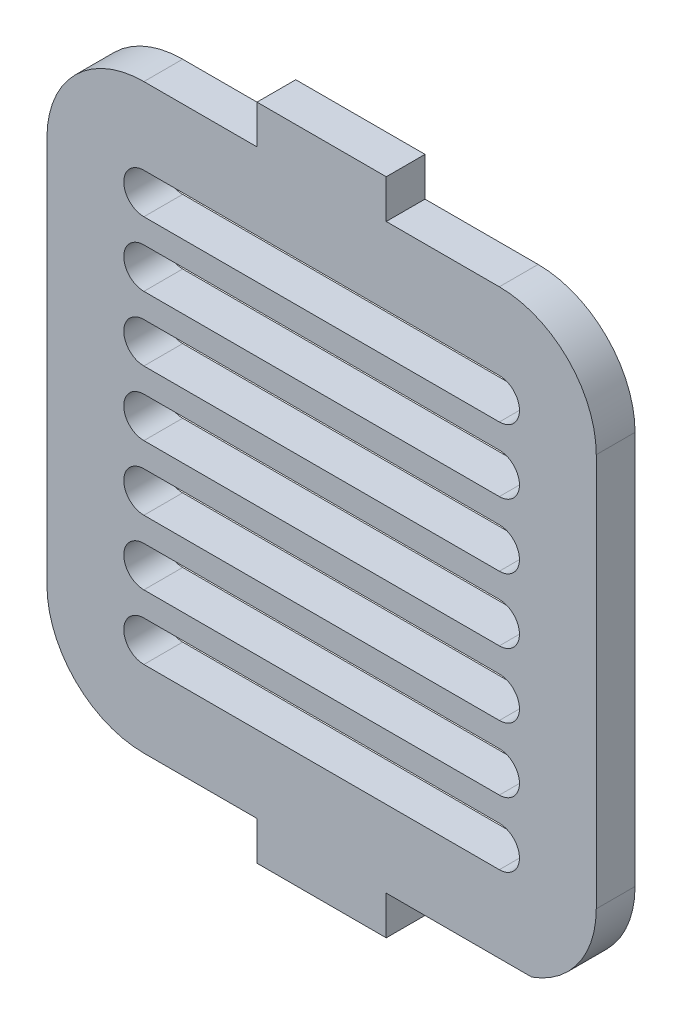
from build123d import *

# Parameters (mm, degrees)
SKETCH1_W           = 20
SKETCH1_H           = 6
BOSS_EXTRUDE1_DEPTH = 6


with BuildPart() as part:
    # Sketch1 → Boss-Extrude1 (new body)
    # profile 1 of 3: a face of its own
    with BuildSketch(Plane.XY):
        with BuildLine():
            ThreePointArc((27.5, 45), (38.106601718, 40.606601718), (42.5, 30))
            Line((42.5, 30), (42.5, -30.857864376))
            ThreePointArc((42.5, -30.857864376), (39.747448714, -39.518118414), (32.5, -45))
            Line((32.5, -45), (-27.5, -45))
            ThreePointArc((-27.5, -45), (-38.106601718, -40.606601718), (-42.5, -30))
            Line((-42.5, -30), (-42.5, 30))
            ThreePointArc((-42.5, 30), (-38.106601718, 40.606601718), (-27.5, 45))
            Line((-27.5, 45), (27.5, 45))
        make_face()
        with BuildLine():
            ThreePointArc((27.5, -33.112673684), (30.612673684, -30), (27.5, -26.887326316))
            Line((27.5, -26.887326316), (-27.5, -26.887326316))
            ThreePointArc((-27.5, -26.887326316), (-30.612673684, -30), (-27.5, -33.112673684))
            Line((-27.5, -33.112673684), (27.5, -33.112673684))
        make_face(mode=Mode.SUBTRACT)
        with BuildLine():
            ThreePointArc((27.5, -23.112673684), (30.612673684, -20), (27.5, -16.887326316))
            Line((27.5, -16.887326316), (-27.5, -16.887326316))
            ThreePointArc((-27.5, -16.887326316), (-30.612673684, -20), (-27.5, -23.112673684))
            Line((-27.5, -23.112673684), (27.5, -23.112673684))
        make_face(mode=Mode.SUBTRACT)
        with BuildLine():
            ThreePointArc((27.5, -13.112673684), (30.612673684, -10), (27.5, -6.887326316))
            Line((27.5, -6.887326316), (-27.5, -6.887326316))
            ThreePointArc((-27.5, -6.887326316), (-30.612673684, -10), (-27.5, -13.112673684))
            Line((-27.5, -13.112673684), (27.5, -13.112673684))
        make_face(mode=Mode.SUBTRACT)
        with BuildLine():
            ThreePointArc((27.5, -3.112673684), (30.612673684, 0), (27.5, 3.112673684))
            Line((27.5, 3.112673684), (-27.5, 3.112673684))
            ThreePointArc((-27.5, 3.112673684), (-30.612673684, 0), (-27.5, -3.112673684))
            Line((-27.5, -3.112673684), (27.5, -3.112673684))
        make_face(mode=Mode.SUBTRACT)
        with BuildLine():
            ThreePointArc((27.5, 6.887326316), (30.612673684, 10), (27.5, 13.112673684))
            Line((27.5, 13.112673684), (-27.5, 13.112673684))
            ThreePointArc((-27.5, 13.112673684), (-30.612673684, 10), (-27.5, 6.887326316))
            Line((-27.5, 6.887326316), (27.5, 6.887326316))
        make_face(mode=Mode.SUBTRACT)
        with BuildLine():
            ThreePointArc((27.5, 16.887326316), (30.612673684, 20), (27.5, 23.112673684))
            Line((27.5, 23.112673684), (-27.5, 23.112673684))
            ThreePointArc((-27.5, 23.112673684), (-30.612673684, 20), (-27.5, 16.887326316))
            Line((-27.5, 16.887326316), (27.5, 16.887326316))
        make_face(mode=Mode.SUBTRACT)
        with BuildLine():
            ThreePointArc((27.5, 26.887326316), (30.612673684, 30), (27.5, 33.112673684))
            Line((27.5, 33.112673684), (-27.5, 33.112673684))
            ThreePointArc((-27.5, 33.112673684), (-30.612673684, 30), (-27.5, 26.887326316))
            Line((-27.5, 26.887326316), (27.5, 26.887326316))
        make_face(mode=Mode.SUBTRACT)
    # profile 2 of 3: a face of its own
    with BuildSketch(Plane.XY):
        with Locations((0, 48)):
            Rectangle(SKETCH1_W, SKETCH1_H)
    # profile 3 of 3: a face of its own
    with BuildSketch(Plane.XY):
        with Locations((0, -48)):
            Rectangle(SKETCH1_W, SKETCH1_H)
    extrude(amount=BOSS_EXTRUDE1_DEPTH)


solid = part.part
